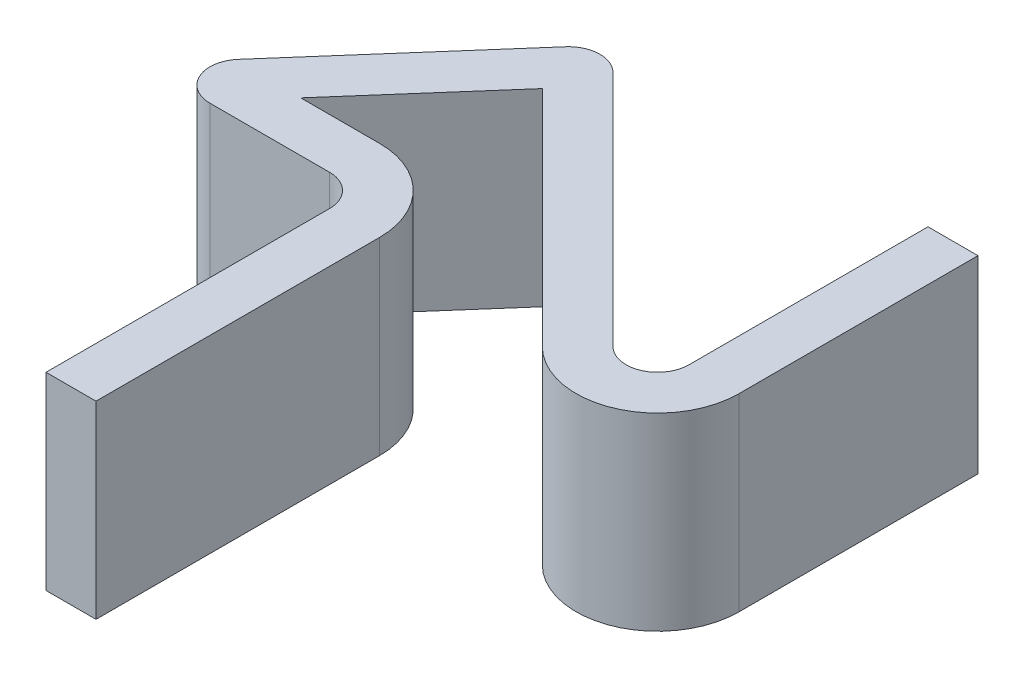
from build123d import *

# Parameters (mm, degrees)
BOSS_EXTRUDE2_DEPTH = 1.5


with BuildPart() as part:
    # Sketch8 → Boss-Extrude2 (new, symmetric)
    with BuildSketch(Plane(origin=(0, 0, 0), x_dir=(1, 0, 0), z_dir=(0, 1, 0))):
        with BuildLine():
            Line((0, 0), (0, 4.5))
            ThreePointArc((0, 4.5), (-0.146446609, 4.853553391), (-0.5, 5))
            Line((-0.5, 5), (-2.398115887, 5))
            ThreePointArc((-2.398115887, 5), (-2.853432344, 5.293391859), (-2.774404234, 5.829252304))
            Line((-2.774404234, 5.829252304), (-0.351933318, 8.597790494))
            ThreePointArc((-0.351933318, 8.597790494), (0.007716061, 8.768261258), (0.37790842, 8.62209158))
            Line((0.37790842, 8.62209158), (4.146446609, 4.853553391))
            ThreePointArc((4.146446609, 4.853553391), (4.691341716, 4.745167015), (5, 5.207106781))
            Line((5, 5.207106781), (5, 9))
            Line((5, 9), (5.79375, 9))
            Line((5.79375, 9), (5.79375, 5.207106781))
            ThreePointArc((5.79375, 5.207106781), (4.995096691, 4.011837636), (3.585180602, 4.292287383))
            Line((3.585180602, 4.292287383), (0.038663609, 7.838804376))
            Line((0.038663609, 7.838804376), (-1.75075897, 5.79375))
            Line((-1.75075897, 5.79375), (-0.5, 5.79375))
            ThreePointArc((-0.5, 5.79375), (0.414819398, 5.414819398), (0.79375, 4.5))
            Line((0.79375, 4.5), (0.79375, 0))
            Line((0.79375, 0), (0, 0))
        make_face()
    extrude(amount=BOSS_EXTRUDE2_DEPTH, both=True)


solid = part.part
